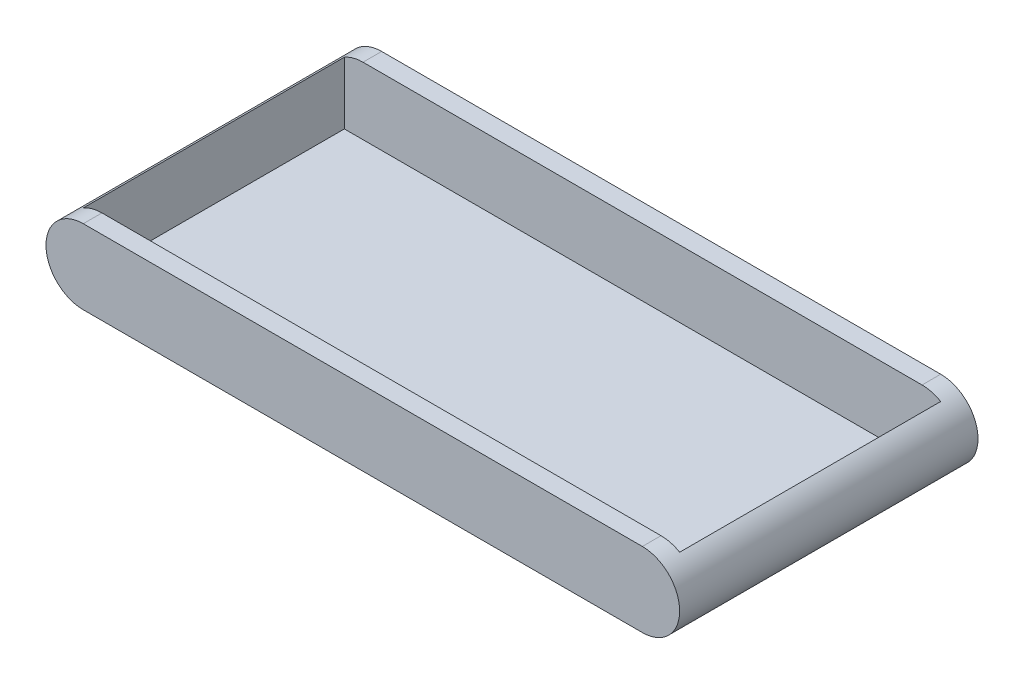
from build123d import *

# Parameters (mm, degrees)
BOSS_EXTRUDE1_DEPTH = 80
SKETCH2_W           = 159.903810567
SKETCH2_H           = 70
CUT_EXTRUDE1_DEPTH  = 18


with BuildPart() as part:
    # Sketch1 → Boss-Extrude1 (new body)
    with BuildSketch(Plane.XY):
        with BuildLine():
            Line((-3.900533574, 10.886474949), (126.003276993, 10.886474949))
            ThreePointArc((126.003276993, 10.886474949), (136.003276993, 0.886474949), (126.003276993, -9.113525051))
            Line((126.003276993, -9.113525051), (-3.900533574, -9.113525051))
            Line((-3.900533574, -9.113525051), (-23.900533574, -9.113525051))
            ThreePointArc((-23.900533574, -9.113525051), (-33.900533574, 0.886474949), (-23.900533574, 10.886474949))
            Line((-23.900533574, 10.886474949), (-3.900533574, 10.886474949))
        make_face()
    extrude(amount=-BOSS_EXTRUDE1_DEPTH)

    # Sketch2 → Cut-Extrude1 (cut)
    with BuildSketch(Plane(origin=(0, 10.886474949, 0), x_dir=(1, 0, 0), z_dir=(0, 1, 0))):
        with Locations((51.05137171, 40)):
            Rectangle(SKETCH2_W, SKETCH2_H)
    extrude(amount=-CUT_EXTRUDE1_DEPTH, mode=Mode.SUBTRACT)


solid = part.part
